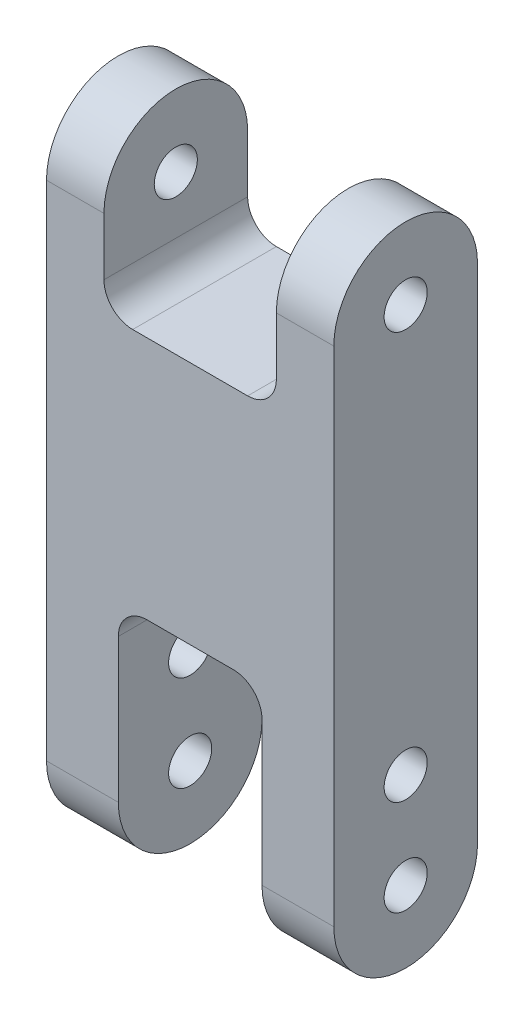
from build123d import *

# Parameters (mm, degrees)
BOSS_EXTRU_1_DEPTH      = 10
ESQUISSE2_R             = 1.5
ENL_V_MAT_EXTRU_1_DEPTH = 35.183235498


with BuildPart() as part:
    # Esquisse1 → Boss.-Extru.1 (new body)
    with BuildSketch(Plane.XY):
        with BuildLine():
            Line((0.481491326, 8.144757028), (-7.518508674, 8.144757028))
            ThreePointArc((-7.518508674, 8.144757028), (-8.932722237, 8.730543466), (-9.518508674, 10.144757028))
            Line((-9.518508674, 10.144757028), (-9.518508674, 19.144757028))
            Line((-9.518508674, 19.144757028), (-13.518508674, 19.144757028))
            Line((-13.518508674, 19.144757028), (-13.518508674, -25.855242972))
            Line((-13.518508674, -25.855242972), (-8.518508674, -25.855242972))
            Line((-8.518508674, -25.855242972), (-8.518508674, -10.855242972))
            ThreePointArc((-8.518508674, -10.855242972), (-7.932722237, -9.441029409), (-6.518508674, -8.855242972))
            Line((-6.518508674, -8.855242972), (-0.518508674, -8.855242972))
            ThreePointArc((-0.518508674, -8.855242972), (0.895704888, -9.441029409), (1.481491326, -10.855242972))
            Line((1.481491326, -10.855242972), (1.481491326, -25.855242972))
            Line((1.481491326, -25.855242972), (6.481491326, -25.855242972))
            Line((6.481491326, -25.855242972), (6.481491326, 19.144757028))
            Line((6.481491326, 19.144757028), (2.481491326, 19.144757028))
            Line((2.481491326, 19.144757028), (2.481491326, 10.144757028))
            ThreePointArc((2.481491326, 10.144757028), (1.895704888, 8.730543466), (0.481491326, 8.144757028))
        make_face()
    extrude(amount=BOSS_EXTRU_1_DEPTH)

    # Esquisse2 → Enlèv. mat.-Extru.1 (cut, through all)
    with BuildSketch(Plane.ZY.offset(13.518508674)):
        with BuildLine():
            ThreePointArc((10, -20.855242972), (8.535533906, -24.390776877), (5, -25.855242972))
            Line((5, -25.855242972), (10, -25.855242972))
            Line((10, -25.855242972), (10, -20.855242972))
        make_face()
        with BuildLine():
            ThreePointArc((5, -25.855242972), (1.464466094, -24.390776877), (0, -20.855242972))
            Line((0, -20.855242972), (0, -25.855242972))
            Line((0, -25.855242972), (5, -25.855242972))
        make_face()
        with Locations((5, -20.855242972)):
            Circle(ESQUISSE2_R)
        with BuildLine():
            Line((10, 19.144757028), (5, 19.144757028))
            ThreePointArc((5, 19.144757028), (8.535533906, 17.680290934), (10, 14.144757028))
            Line((10, 14.144757028), (10, 19.144757028))
        make_face()
        with BuildLine():
            Line((0, 19.144757028), (0, 14.144757028))
            ThreePointArc((0, 14.144757028), (1.464466094, 17.680290934), (5, 19.144757028))
            Line((5, 19.144757028), (0, 19.144757028))
        make_face()
        with Locations((5, 14.144757028)):
            Circle(ESQUISSE2_R)
        with Locations((5, -14.195242972)):
            Circle(ESQUISSE2_R)
    extrude(amount=-ENL_V_MAT_EXTRU_1_DEPTH, mode=Mode.SUBTRACT)


solid = part.part
